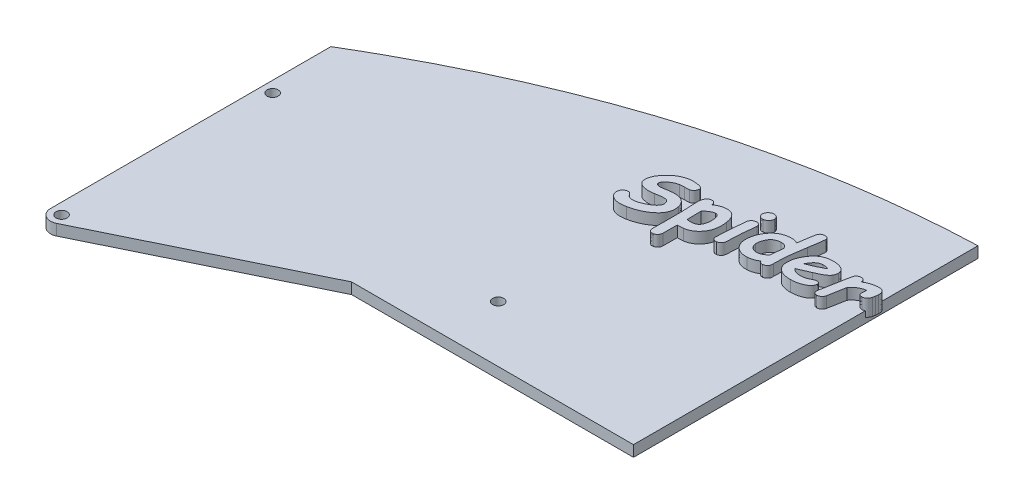
from build123d import *

# Parameters (mm, degrees)
SKETCH1_R           = 5
BOSS_EXTRUDE1_DEPTH = 5
BOSS_EXTRUDE4_DEPTH = 5
BOSS_EXTRUDE5_DEPTH = 15
BOSS_EXTRUDE6_DEPTH = 15


with BuildPart() as part:
    # Sketch1 → Boss-Extrude1 (new, symmetric)
    with BuildSketch(Plane(origin=(0, 0, 0), x_dir=(1, 0, 0), z_dir=(0, 1, 0))):
        with BuildLine():
            Line((-276.16, -130), (-276.16, 61.45))
            ThreePointArc((-276.16, 61.45), (-272.385116744, 69.276105131), (-263.910415696, 71.193683619))
            Line((-263.910415696, 71.193683619), (2.249584304, 9.743683619))
            ThreePointArc((2.249584304, 9.743683619), (9.935404568, 1.134784593), (4.388758686, -8.985477015))
            Line((4.388758686, -8.985477015), (0, -11.129069701))
            Line((0, -11.129069701), (173.84, -11.129069701))
            Line((173.84, -11.129069701), (173.84, -51.129069701))
            Line((173.84, -51.129069701), (0, -51.129069701))
            Line((0, -51.129069701), (-81.895384615, -51.129069701))
            Line((-81.895384615, -51.129069701), (-261.771241314, -138.985477015))
            ThreePointArc((-261.771241314, -138.985477015), (-271.456810981, -138.481968724), (-276.16, -130))
        make_face()
        with Locations(Location((-266.16, 61.45, 0), (0, 0, 270))):
            Circle(SKETCH1_R, mode=Mode.SUBTRACT)
        with Locations(Location((0, 0, 0), (0, 0, 270))):
            Circle(SKETCH1_R, mode=Mode.SUBTRACT)
        with Locations(Location((-266.16, -130, 0), (0, 0, 270))):
            Circle(SKETCH1_R, mode=Mode.SUBTRACT)
    extrude(amount=BOSS_EXTRUDE1_DEPTH, both=True)

    # Sketch6 → Boss-Extrude4 (add, symmetric)
    with BuildSketch(Plane(origin=(0, 0, 0), x_dir=(1, 0, 0), z_dir=(0, 1, 0))):
        with BuildLine():
            Line((-276.16, 61.45), (-276.16, 124.312394844))
            add(Edge.make_bspline(
                [(-276.16, 124.312394844), (-60.151682098, 253.231064879), (173.84, 261.45)],
                knots=[0, 0, 0, 0.880135939, 0.880135939, 0.880135939], degree=2))
            Line((173.84, 261.45), (173.84, -11.129069701))
            Line((173.84, -11.129069701), (0, -11.129069701))
            Line((0, -11.129069701), (9.935404568, 1.134784593))
            Line((9.935404568, 1.134784593), (2.249584304, 9.743683619))
            Line((2.249584304, 9.743683619), (-263.910415696, 71.193683619))
            Line((-263.910415696, 71.193683619), (-276.16, 61.45))
        make_face()
    extrude(amount=BOSS_EXTRUDE4_DEPTH, both=True)

    # Sketch7 → Boss-Extrude5 (add)
    # profile 1 of 7: a face of its own
    with BuildSketch(Plane(origin=(0, 0, 0), x_dir=(1, 0, 0), z_dir=(0, 1, 0))):
        with BuildLine():
            add(Edge.make_bspline(
                [(176.518734712, 163.267618198), (176.456930799, 162.976702904), (176.333813279, 162.397180214), (175.989113084, 161.564369246), (175.524778373, 160.768651896), (174.945008319, 160.021929376), (174.247707671, 159.357338722), (173.37305975, 158.911121203), (172.377582905, 158.645804684), (171.670227243, 158.63476937), (171.300286997, 158.628998007)],
                knots=[0, 0, 0, 0, 0.929323082, 1.85127363, 2.806580006, 3.805490242, 4.804815835, 5.792818837, 6.845665359, 8, 8, 8, 8], degree=3))
            add(Edge.make_bspline(
                [(171.300286997, 158.628998007), (171.041712856, 158.642585868), (170.556196247, 158.668099371), (169.88191695, 158.822321589), (169.311439979, 159.074458954), (168.842525763, 159.416575587), (168.474091509, 159.855933557), (168.240541922, 160.396171683), (168.09897489, 161.01761733), (168.091946577, 161.459773402), (168.088226587, 161.693800633)],
                knots=[0, 0, 0, 0, 1.220790233, 2.292239788, 3.245151792, 4.146014003, 5.010153794, 5.917512134, 6.897767325, 8, 8, 8, 8], degree=3))
            add(Edge.make_bspline(
                [(168.088226587, 161.693800633), (168.097295909, 161.869017318), (168.116151999, 162.233311534), (168.176533877, 162.593092003), (168.207873536, 162.779826789)],
                knots=[0, 0, 0, 0, 0.961951506, 2, 2, 2, 2], degree=3))
            Line((168.207873536, 162.779826789), (168.566814384, 165.909054696))
            add(Edge.make_bspline(
                [(168.566814384, 165.909054696), (167.984314857, 165.820757636), (166.836729852, 165.646803192), (165.182177673, 165.165677393), (163.61656855, 164.540934536), (162.145417686, 163.752318941), (160.762525932, 162.812257349), (159.490964563, 161.691209798), (158.288797617, 160.430761645), (157.592093075, 159.48098847), (157.237168639, 158.997142466)],
                knots=[0, 0, 0, 0, 1.031863698, 2.032879432, 3.012618297, 3.982282115, 4.95342141, 5.936976143, 6.94902712, 8, 8, 8, 8], degree=3))
            Line((157.237168639, 158.997142466), (154.4024563, 143.498260716))
            add(Edge.make_bspline(
                [(154.4024563, 143.498260716), (154.335595854, 143.21594257), (154.203763456, 142.659280435), (153.834750012, 141.880992166), (153.325426801, 141.180921595), (152.697964433, 140.55968838), (151.964560789, 140.056749203), (151.157542763, 139.685470877), (150.27727386, 139.480258225), (149.669759615, 139.465452027), (149.358877203, 139.457875272)],
                knots=[0, 0, 0, 0, 0.987406431, 1.946923278, 2.913884298, 3.927496301, 4.943266075, 5.931282102, 6.941377896, 8, 8, 8, 8], degree=3))
            add(Edge.make_bspline(
                [(149.358877203, 139.457875272), (149.083458753, 139.47546062), (148.561023811, 139.508817863), (147.837057374, 139.763407596), (147.210366015, 140.139361085), (146.720295925, 140.679401896), (146.35731318, 141.320738733), (146.143445807, 142.054091021), (146.093732924, 142.865634424), (146.164735698, 143.419145424), (146.202038462, 143.709943781)],
                knots=[0, 0, 0, 0, 1.073170499, 2.035672514, 2.966705473, 3.899356348, 4.849093514, 5.823530431, 6.856547073, 8, 8, 8, 8], degree=3))
            Line((146.202038462, 143.709943781), (149.929501116, 163.967092671))
            Line((149.929501116, 163.967092671), (150.82225143, 168.384826187))
            add(Edge.make_bspline(
                [(150.82225143, 168.384826187), (150.885148455, 168.723335335), (151.001355023, 169.348754208), (151.227655734, 170.200790076), (151.444171429, 170.902724381), (151.703318414, 171.464486987), (152.00053857, 171.934982779), (152.37558185, 172.336451671), (152.81237468, 172.709816639), (153.318753481, 173.038419752), (153.880489995, 173.317547729), (154.501022543, 173.496295857), (155.155546721, 173.61576844), (155.607567561, 173.613589406), (155.838219693, 173.612477514)],
                knots=[0, 0, 0, 0, 1.529410258, 2.825690373, 3.916473868, 4.788712898, 5.567746583, 6.378466368, 7.219900511, 8.116104303, 9.055150556, 9.995383723, 10.977106855, 12, 12, 12, 12], degree=3))
            add(Edge.make_bspline(
                [(155.838219693, 173.612477514), (156.112505183, 173.597635906), (156.628013843, 173.569741695), (157.34702144, 173.382658517), (157.960885173, 173.086202476), (158.469357046, 172.676586316), (158.859617359, 172.150115827), (159.122934936, 171.514967312), (159.290727983, 170.780224016), (159.30805637, 170.254171524), (159.317184836, 169.977050975)],
                knots=[0, 0, 0, 0, 1.147678115, 2.157015324, 3.08752507, 3.982154202, 4.863220525, 5.800882371, 6.841521149, 8, 8, 8, 8], degree=3))
            add(Edge.make_bspline(
                [(159.317184836, 169.977050975), (159.837248027, 170.294992397), (160.860881516, 170.920792286), (162.456917279, 171.709320298), (164.056392142, 172.385054528), (165.669930695, 172.932241993), (167.298792754, 173.339605168), (168.939503058, 173.610377566), (170.594096073, 173.781222316), (171.701773389, 173.773042488), (172.257462592, 173.768938909)],
                knots=[0, 0, 0, 0, 1.068448707, 2.103013433, 3.11816224, 4.111711965, 5.08771541, 6.058843267, 7.026178632, 8, 8, 8, 8], degree=3))
            add(Edge.make_bspline(
                [(172.257462592, 173.768938909), (172.658216512, 173.743378014), (173.412483506, 173.695269342), (174.463938421, 173.408235211), (175.354850317, 172.942026896), (176.08678303, 172.292601161), (176.628328261, 171.453134444), (176.992682054, 170.450469804), (177.204031316, 169.28649798), (177.207283339, 168.456329656), (177.209005574, 168.016681727)],
                knots=[0, 0, 0, 0, 1.106444953, 2.082462242, 2.984149, 3.859766888, 4.752339812, 5.711830198, 6.788210675, 8, 8, 8, 8], degree=3))
            add(Edge.make_bspline(
                [(177.209005574, 168.016681727), (177.182952834, 167.592402928), (177.127940674, 166.696508955), (176.970014456, 165.812823027), (176.886879172, 165.347634395)],
                knots=[0, 0, 0, 0, 0.947162974, 2, 2, 2, 2], degree=3))
            Line((176.886879172, 165.347634395), (176.518734712, 163.267618198))
        make_face()
    # profile 2 of 7: a face of its own
    with BuildSketch(Plane(origin=(0, 0, 0), x_dir=(1, 0, 0), z_dir=(0, 1, 0))):
        with BuildLine():
            add(Edge.make_bspline(
                [(118.660529309, 150.443129323), (118.893382166, 150.187955108), (119.357461716, 149.679388729), (120.170216475, 149.034688231), (121.059673375, 148.486649564), (122.031991438, 148.046986532), (123.07713874, 147.702020601), (124.205534196, 147.479638551), (125.409021899, 147.333754286), (126.240776541, 147.332798958), (126.667671306, 147.332308639)],
                knots=[0, 0, 0, 0, 0.931654172, 1.85680199, 2.790369816, 3.746889916, 4.732010299, 5.755675512, 6.848109376, 8, 8, 8, 8], degree=3))
            add(Edge.make_bspline(
                [(126.667671306, 147.332308639), (127.332051762, 147.362115626), (128.633162388, 147.420489088), (130.520354747, 147.78118311), (132.302937103, 148.331176274), (133.395867004, 148.881419199), (133.938524384, 149.154623714)],
                knots=[0, 0, 0, 0, 1.053289028, 2.062742112, 3.038120113, 4, 4, 4, 4], degree=3))
            add(Edge.make_bspline(
                [(133.938524384, 149.154623714), (134.379220528, 149.393698389), (135.193908469, 149.835661082), (136.377290267, 150.318646184), (137.393196427, 150.659540748), (138.032210282, 150.719773994), (138.319443453, 150.746848502)],
                knots=[0, 0, 0, 0, 1.279371579, 2.365095794, 3.265119661, 4, 4, 4, 4], degree=3))
            add(Edge.make_bspline(
                [(138.319443453, 150.746848502), (138.534690928, 150.744027953), (138.937339179, 150.738751751), (139.502654435, 150.635934382), (139.986963291, 150.467115843), (140.391984407, 150.212842492), (140.701797494, 149.870443131), (140.928755973, 149.455034774), (141.053380181, 148.961980674), (141.077165904, 148.612270084), (141.089730512, 148.427538406)],
                knots=[0, 0, 0, 0, 1.247072542, 2.332810536, 3.318205731, 4.206908105, 5.076147483, 5.96822998, 6.926734577, 8, 8, 8, 8], degree=3))
            add(Edge.make_bspline(
                [(141.089730512, 148.427538406), (141.078963928, 148.128711151), (141.057698764, 147.5384951), (140.83632945, 146.669168028), (140.453193363, 145.846534306), (139.91369057, 145.064650366), (139.234778799, 144.310561298), (138.390305284, 143.607062655), (137.392451199, 142.943553416), (136.265816558, 142.322666262), (135.051234163, 141.751152593), (133.781984645, 141.254772702), (132.489062406, 140.823822901), (131.163962346, 140.456207449), (129.805218978, 140.191202564), (128.418927069, 139.970225312), (127.001052235, 139.846243095), (126.045085783, 139.811874211), (125.563237927, 139.794550828)],
                knots=[0, 0, 0, 0, 0.741873545, 1.465280245, 2.212780045, 2.987160223, 3.818964515, 4.728306554, 5.712126274, 6.794625551, 7.924161431, 9.047498119, 10.181276281, 11.311970725, 12.46392634, 13.621551001, 14.801160282, 16, 16, 16, 16], degree=3))
            add(Edge.make_bspline(
                [(125.563237927, 139.794550828), (124.980168145, 139.797168184), (123.846407125, 139.80225755), (122.191335021, 139.918948556), (120.634273353, 140.146594005), (119.171773073, 140.483095952), (117.79808658, 140.894426536), (116.527703483, 141.435853435), (115.352669033, 142.072257407), (114.273733374, 142.803169151), (113.319118555, 143.636442517), (112.470344469, 144.529327278), (111.757618251, 145.506073008), (111.165405625, 146.548797382), (110.699668216, 147.664073899), (110.37302822, 148.852066001), (110.153156126, 150.110035842), (110.118757119, 150.975991974), (110.101170623, 151.418712141)],
                knots=[0, 0, 0, 0, 1.283318363, 2.495372563, 3.649128548, 4.743523394, 5.796652645, 6.801376746, 7.777480309, 8.734687246, 9.663528147, 10.561764431, 11.441116455, 12.318157364, 13.196107863, 14.09409023, 15.025603424, 16, 16, 16, 16], degree=3))
            add(Edge.make_bspline(
                [(110.101170623, 151.418712141), (110.108121397, 152.051284534), (110.122033493, 153.317389247), (110.350253608, 155.212724449), (110.750290491, 157.095654492), (111.310462067, 158.96989884), (112.055902915, 160.825383347), (112.961484593, 162.670466008), (114.03477375, 164.506756407), (115.25718423, 166.304568749), (116.613190919, 168.001842681), (118.121962571, 169.491571336), (119.742739643, 170.766499532), (121.481987504, 171.815188107), (123.341376021, 172.626412099), (125.303404022, 173.229659125), (127.38397887, 173.604312655), (128.810571059, 173.668084374), (129.539198091, 173.700655559)],
                knots=[0, 0, 0, 0, 0.927231402, 1.855869874, 2.793878035, 3.747563106, 4.72090259, 5.722965816, 6.759319796, 7.837527429, 8.909106018, 9.939907564, 10.939847407, 11.926735692, 12.909832251, 13.907492027, 14.931258783, 16, 16, 16, 16], degree=3))
            add(Edge.make_bspline(
                [(129.539198091, 173.700655559), (130.014733549, 173.70112331), (130.941762341, 173.702035161), (132.29134831, 173.644668348), (133.559094819, 173.500641565), (134.749974949, 173.313486238), (135.859252335, 173.055356278), (136.89386798, 172.74659137), (137.839481499, 172.357339067), (138.70803141, 171.919568993), (139.486048819, 171.420935783), (140.169705743, 170.872716155), (140.752070751, 170.263555778), (141.232741835, 169.602775367), (141.603846016, 168.884546089), (141.875026819, 168.117230765), (142.042164189, 167.295854012), (142.069696928, 166.728158281), (142.083720553, 166.439006093)],
                knots=[0, 0, 0, 0, 1.408853043, 2.746477291, 3.999137191, 5.187076673, 6.315930071, 7.371097975, 8.382124301, 9.341453258, 10.249098412, 11.115007308, 11.931467126, 12.738717787, 13.527384673, 14.317934821, 15.143250866, 16, 16, 16, 16], degree=3))
            add(Edge.make_bspline(
                [(142.083720553, 166.439006093), (142.080521981, 166.162529343), (142.074203917, 165.616411157), (141.960722392, 164.813819334), (141.767117093, 164.041999602), (141.488442222, 163.306112321), (141.137762173, 162.595369598), (140.692159744, 161.927097963), (140.171757509, 161.285836903), (139.562604883, 160.668184306), (138.833843148, 160.062239276), (137.975496891, 159.434649263), (136.961889343, 158.798417347), (135.805739651, 158.135647629), (134.508803665, 157.445095451), (133.059447702, 156.740951888), (131.4694316, 156.001756871), (130.350503568, 155.523467598), (129.769288378, 155.275025355)],
                knots=[0, 0, 0, 0, 0.748633269, 1.478758134, 2.190524498, 2.90083282, 3.60723832, 4.333566851, 5.072349253, 5.842462199, 6.680192169, 7.637981556, 8.721933263, 9.921186994, 11.248907463, 12.702658412, 14.287231205, 16, 16, 16, 16], degree=3))
            Line((129.769288378, 155.275025355), (118.660529309, 150.443129323))
        make_face()
        with BuildLine():
            Line((119.093099049, 158.33062437), (126.56643158, 161.432241442))
            add(Edge.make_bspline(
                [(126.56643158, 161.432241442), (127.227452097, 161.735975405), (128.516819059, 162.328429837), (130.377296144, 163.245181252), (132.109349073, 164.178726896), (133.215829762, 164.813761787), (133.754452154, 165.12288965)],
                knots=[0, 0, 0, 0, 1.079829896, 2.106284078, 3.078160326, 4, 4, 4, 4], degree=3))
            add(Edge.make_bspline(
                [(133.754452154, 165.12288965), (133.4190377, 165.29810493), (132.712430039, 165.667225753), (131.478885921, 165.987440346), (130.073461871, 166.181374979), (129.073697699, 166.187350066), (128.54520805, 166.190508583)],
                knots=[0, 0, 0, 0, 0.841563456, 1.772896718, 2.822721333, 4, 4, 4, 4], degree=3))
            add(Edge.make_bspline(
                [(128.54520805, 166.190508583), (128.073322068, 166.158202423), (127.139210334, 166.094251458), (125.774784062, 165.700311702), (124.48624561, 165.061864714), (123.254374142, 164.192073648), (122.102287742, 163.069611303), (121.016468777, 161.711708262), (119.990437912, 160.119583954), (119.400902846, 158.944270536), (119.093099049, 158.33062437)],
                knots=[0, 0, 0, 0, 0.872762196, 1.727657613, 2.605567808, 3.521657875, 4.50472728, 5.569754289, 6.731137637, 8, 8, 8, 8], degree=3))
        make_face(mode=Mode.SUBTRACT)
    # profile 3 of 7: a face of its own
    with BuildSketch(Plane(origin=(0, 0, 0), x_dir=(1, 0, 0), z_dir=(0, 1, 0))):
        with BuildLine():
            add(Edge.make_bspline(
                [(99.380964136, 171.256918432), (99.512612117, 172.183449642), (99.763763079, 173.951036221), (100.126554836, 176.474137885), (100.483658494, 178.736167077), (100.787934216, 180.748028383), (101.089480419, 182.500691115), (101.337554691, 184.003770035), (101.581186388, 185.245082956), (101.786982296, 186.263624736), (102.024090248, 187.11366756), (102.352101743, 187.839447959), (102.786349717, 188.456339993), (103.292488411, 188.982711076), (103.898689594, 189.389987686), (104.578707859, 189.711160991), (105.356752626, 189.909406779), (105.905295866, 189.965953772), (106.191636639, 189.995471426)],
                knots=[0, 0, 0, 0, 2.093012271, 3.992936623, 5.700836037, 7.214682637, 8.543456784, 9.678229977, 10.621528112, 11.372456875, 12.002053847, 12.59148728, 13.143470454, 13.682028092, 14.2149177, 14.767454967, 15.356608793, 16, 16, 16, 16], degree=3))
            add(Edge.make_bspline(
                [(106.191636639, 189.995471426), (106.46784637, 190.003899101), (106.986254222, 190.019716693), (107.722607876, 189.915463342), (108.350623141, 189.677753689), (108.896784513, 189.352228595), (109.306541238, 188.875740957), (109.628378335, 188.309219304), (109.83987717, 187.625072941), (109.885692908, 187.128542389), (109.909895681, 186.86624352)],
                knots=[0, 0, 0, 0, 1.190254643, 2.233945014, 3.179698034, 4.071286247, 4.942233965, 5.854283231, 6.866496575, 8, 8, 8, 8], degree=3))
            add(Edge.make_bspline(
                [(109.909895681, 186.86624352), (109.910305311, 186.7834072), (109.911261324, 186.590079851), (109.901326468, 186.255432121), (109.8753036, 185.834398814), (109.812117516, 185.326440566), (109.753053908, 184.730362059), (109.667875243, 184.049490213), (109.566700054, 183.285568119), (109.446701198, 182.435781931), (109.304579378, 181.498060572), (109.166261004, 180.471134319), (108.980853356, 179.363101752), (108.805262922, 178.164335468), (108.587580032, 176.883896307), (108.368188552, 175.511824667), (108.130774369, 174.057334402), (107.962253718, 173.057682447), (107.875897542, 172.54542404)],
                knots=[0, 0, 0, 0, 0.274720035, 0.641154705, 1.110190553, 1.67312553, 2.338312645, 3.096797245, 3.948691282, 4.894073523, 5.943066964, 7.094215999, 8.330403817, 9.668691931, 11.112261336, 12.637805281, 14.277087839, 16, 16, 16, 16], degree=3))
            add(Edge.make_bspline(
                [(107.875897542, 172.54542404), (107.729067872, 171.689917254), (107.440946874, 170.011172969), (107.061779486, 167.533159266), (106.696121273, 165.151271913), (106.383069116, 162.86234873), (106.120373701, 160.664375785), (105.875166411, 158.564074964), (105.683480571, 156.553858744), (105.529552004, 154.648134485), (105.400394589, 152.868694373), (105.301388943, 151.233148968), (105.214581803, 149.757813104), (105.160765285, 148.43524761), (105.123722509, 147.269416674), (105.101043102, 146.256946104), (105.10872033, 145.400567897), (105.131966765, 144.882394674), (105.142424929, 144.649277612)],
                knots=[0, 0, 0, 0, 1.484364393, 2.912739303, 4.286870655, 5.605341729, 6.863215692, 8.072355805, 9.221361243, 10.31624723, 11.341924858, 12.272325893, 13.118312011, 13.869204645, 14.535825482, 15.113022817, 15.600964493, 16, 16, 16, 16], degree=3))
            add(Edge.make_bspline(
                [(105.142424929, 144.649277612), (105.154655196, 144.413105348), (105.177679197, 143.968500955), (105.164666113, 143.335726883), (105.135916095, 142.778135061), (105.055659732, 142.270270634), (104.881516258, 141.781451859), (104.570319554, 141.291072623), (104.142904384, 140.76437409), (103.596109653, 140.234625255), (102.973572657, 139.726209999), (102.266103975, 139.350750218), (101.514712968, 139.087047931), (100.990624293, 139.028147428), (100.724691413, 138.998260157)],
                knots=[0, 0, 0, 0, 1.051252687, 1.979028168, 2.812994602, 3.532940103, 4.257908989, 5.102519403, 6.101764177, 7.2690366, 8.483506227, 9.661570794, 10.813435124, 12, 12, 12, 12], degree=3))
            add(Edge.make_bspline(
                [(100.724691413, 138.998260157), (100.53739013, 138.993421362), (100.176801985, 138.984105826), (99.652655068, 139.049094109), (99.170615614, 139.181945567), (98.738480094, 139.405944158), (98.340051768, 139.67583832), (97.993950322, 140.029840354), (97.68757026, 140.443955702), (97.529487651, 140.759546469), (97.448205723, 140.921814959)],
                knots=[0, 0, 0, 0, 1.102563406, 2.122629841, 3.100842829, 4.030422413, 4.97810109, 5.92388182, 6.932514518, 8, 8, 8, 8], degree=3))
            add(Edge.make_bspline(
                [(97.448205723, 140.921814959), (97.086272439, 140.692482669), (96.367172665, 140.23683848), (95.243458082, 139.654483309), (94.104167809, 139.142012848), (92.946680657, 138.713431523), (91.774759322, 138.349078429), (90.581391552, 138.072466777), (89.369182206, 137.878948235), (88.551937049, 137.80910035), (88.143354506, 137.774179829)],
                knots=[0, 0, 0, 0, 1.034907349, 2.056184593, 3.054991914, 4.051899287, 5.036744336, 6.018543653, 7.009368894, 8, 8, 8, 8], degree=3))
            add(Edge.make_bspline(
                [(88.143354506, 137.774179829), (87.612605358, 137.753050453), (86.578095871, 137.711866138), (85.063548021, 137.79938405), (83.624836602, 137.992360193), (82.274440266, 138.3390105), (80.99646118, 138.787111914), (79.80568948, 139.374442808), (78.683266964, 140.069572993), (77.667286896, 140.905780689), (76.742505316, 141.817706166), (75.928135618, 142.800000241), (75.221328049, 143.836449706), (74.632291552, 144.935888988), (74.150676109, 146.091788274), (73.784279005, 147.30366216), (73.517172264, 148.572191684), (73.445056929, 149.443106195), (73.408372509, 149.88613255)],
                knots=[0, 0, 0, 0, 1.18951681, 2.31854621, 3.394692272, 4.43668464, 5.436843195, 6.423684731, 7.405894818, 8.388201114, 9.365201779, 10.312216062, 11.242619186, 12.171421166, 13.1020528, 14.043587687, 15.004790704, 16, 16, 16, 16], degree=3))
            add(Edge.make_bspline(
                [(73.408372509, 149.88613255), (73.383647466, 150.558064928), (73.334594033, 151.891150169), (73.480793889, 153.878653009), (73.795534876, 155.833772876), (74.281100575, 157.761351375), (74.959486584, 159.653511089), (75.811686777, 161.512020003), (76.840733064, 163.337451165), (78.019364832, 165.118069238), (79.356285987, 166.781858667), (80.832112017, 168.266942475), (82.440298473, 169.534862532), (84.159282501, 170.616371065), (86.015028095, 171.471345471), (87.986381122, 172.128347043), (90.083804426, 172.574077781), (91.528311964, 172.707384026), (92.266572453, 172.775514328)],
                knots=[0, 0, 0, 0, 0.978479588, 1.941261862, 2.895999431, 3.859196161, 4.831302022, 5.818795368, 6.832810011, 7.879746314, 8.924851139, 9.935662715, 10.921467199, 11.900711292, 12.886019692, 13.8890027, 14.921109195, 16, 16, 16, 16], degree=3))
            add(Edge.make_bspline(
                [(92.266572453, 172.775514328), (92.637679618, 172.791249247), (93.361352682, 172.821932936), (94.41619084, 172.809087835), (95.406660971, 172.71589464), (96.329785158, 172.560457012), (97.192471387, 172.344814616), (97.982974939, 172.043641672), (98.723222085, 171.70247107), (99.163602833, 171.404158374), (99.380964136, 171.256918432)],
                knots=[0, 0, 0, 0, 1.201803594, 2.343562643, 3.410362982, 4.417288943, 5.370730641, 6.281622877, 7.151850551, 8, 8, 8, 8], degree=3))
        make_face()
        with BuildLine():
            add(Edge.make_bspline(
                [(97.853164628, 161.317018022), (97.709168289, 161.616973206), (97.430000252, 162.198501182), (96.864480297, 162.962345073), (96.221111402, 163.607481911), (95.476889767, 164.109245824), (94.653109548, 164.496928847), (93.733814494, 164.738298331), (92.72990421, 164.861258539), (92.036745564, 164.83645008), (91.677541318, 164.823594)],
                knots=[0, 0, 0, 0, 1.044146857, 2.024304434, 2.972467305, 3.895566795, 4.832077149, 5.821965218, 6.871312727, 8, 8, 8, 8], degree=3))
            add(Edge.make_bspline(
                [(91.677541318, 164.823594), (91.213030117, 164.78408371), (90.311152067, 164.707371969), (89.017973688, 164.437833698), (87.82952259, 164.054930066), (86.752574927, 163.542854662), (85.774289357, 162.923670435), (84.901686487, 162.182163482), (84.141154261, 161.318974329), (83.508245716, 160.349868819), (82.966988801, 159.335666891), (82.492404498, 158.31353839), (82.110409472, 157.289843672), (81.786894502, 156.276327399), (81.572575649, 155.257808626), (81.417905595, 154.247406645), (81.364385831, 153.236572049), (81.386205022, 152.56740973), (81.397107283, 152.233053481)],
                knots=[0, 0, 0, 0, 1.226934033, 2.382170481, 3.470684932, 4.508002166, 5.514427839, 6.511795531, 7.513637283, 8.533307029, 9.552848709, 10.539885478, 11.498840503, 12.429147015, 13.338873689, 14.237044141, 15.119114611, 16, 16, 16, 16], degree=3))
            add(Edge.make_bspline(
                [(81.397107283, 152.233053481), (81.415872231, 151.995994201), (81.452988964, 151.527095166), (81.608207352, 150.847970847), (81.807697252, 150.195556544), (82.077831413, 149.5810536), (82.39729736, 148.991313055), (82.802076543, 148.451343227), (83.250618402, 147.930232814), (83.767029212, 147.457288019), (84.318224602, 147.027302145), (84.907633027, 146.666547195), (85.51507357, 146.358875135), (86.151438948, 146.121215643), (86.807825278, 145.943850531), (87.486497068, 145.837489697), (88.188502124, 145.773705476), (88.664818324, 145.79705049), (88.907254259, 145.80893266)],
                knots=[0, 0, 0, 0, 1.034968957, 2.047150178, 3.028124661, 4.004167297, 4.967677145, 5.943719781, 6.93853506, 7.960207335, 8.989721987, 9.980306096, 10.966822082, 11.952613088, 12.935226018, 13.924275248, 14.943495366, 16, 16, 16, 16], degree=3))
            add(Edge.make_bspline(
                [(88.907254259, 145.80893266), (89.245790839, 145.841456139), (89.929097773, 145.907101979), (90.94155203, 146.142134206), (91.940143122, 146.489022535), (92.934366019, 146.929121409), (93.907567245, 147.502601399), (94.889166764, 148.160040905), (95.844367655, 148.949453619), (96.454752641, 149.532510938), (96.767138472, 149.830910881)],
                knots=[0, 0, 0, 0, 0.903688745, 1.824017911, 2.755418455, 3.712200489, 4.709984491, 5.755428712, 6.851262264, 8, 8, 8, 8], degree=3))
            add(Edge.make_bspline(
                [(96.767138472, 149.830910881), (96.767302018, 149.889196036), (96.767689361, 150.027239823), (96.763482208, 150.272957425), (96.787694426, 150.588802379), (96.813829609, 150.981515412), (96.85398408, 151.444319327), (96.884698443, 151.982137442), (96.94514348, 152.588940175), (97.008070333, 153.270123704), (97.082280348, 154.024776551), (97.165136553, 154.853097146), (97.256557798, 155.752050407), (97.359273442, 156.724412037), (97.468209011, 157.767648376), (97.589493677, 158.887246872), (97.716831211, 160.077744517), (97.806929883, 160.896743257), (97.853164628, 161.317018022)],
                knots=[0, 0, 0, 0, 0.242447582, 0.574217958, 1.021560497, 1.558862703, 2.211641618, 2.953502731, 3.799162018, 4.747646866, 5.798967464, 6.953131276, 8.210143932, 9.557318191, 11.020040682, 12.572934589, 14.241378115, 16, 16, 16, 16], degree=3))
        make_face(mode=Mode.SUBTRACT)
    # profile 4 of 7: a face of its own
    with BuildSketch(Plane(origin=(0, 0, 0), x_dir=(1, 0, 0), z_dir=(0, 1, 0))):
        with BuildLine():
            add(Edge.make_bspline(
                [(61.000585691, 178.102373044), (60.98774065, 178.447050094), (60.962294009, 179.129871871), (61.206434726, 180.14041215), (61.683131454, 181.092103098), (62.372019462, 181.95086764), (63.183914726, 182.709927438), (64.09145072, 183.293641606), (65.063633646, 183.703907308), (65.746048176, 183.810220953), (66.090182845, 183.863833837)],
                knots=[0, 0, 0, 0, 0.974232978, 1.930002285, 2.910273955, 3.969915742, 5.034827994, 6.048191869, 7.015723117, 8, 8, 8, 8], degree=3))
            add(Edge.make_bspline(
                [(66.090182845, 183.863833837), (66.372893667, 183.881861995), (66.926831046, 183.917185972), (67.738186751, 183.766844291), (68.503823448, 183.490308667), (69.193187633, 183.056930951), (69.786986114, 182.522073656), (70.257812698, 181.903112374), (70.558900255, 181.192745446), (70.64096659, 180.688058918), (70.682784979, 180.430886751)],
                knots=[0, 0, 0, 0, 1.063388612, 2.0835803, 3.081740158, 4.114356611, 5.128772592, 6.078674018, 7.020953527, 8, 8, 8, 8], degree=3))
            add(Edge.make_bspline(
                [(70.682784979, 180.430886751), (70.695631464, 180.092270704), (70.721196403, 179.418413324), (70.473840166, 178.419675741), (70.006222713, 177.466541133), (69.330679674, 176.589888697), (68.520634142, 175.81494993), (67.600448439, 175.214900588), (66.603753236, 174.789140688), (65.894641869, 174.684995479), (65.537966155, 174.632611512)],
                knots=[0, 0, 0, 0, 0.948731928, 1.888008606, 2.85618084, 3.915272521, 4.982932903, 5.992402328, 6.990199052, 8, 8, 8, 8], degree=3))
            add(Edge.make_bspline(
                [(65.537966155, 174.632611512), (65.249195298, 174.618484125), (64.689229779, 174.591089221), (63.872197672, 174.734279362), (63.118310287, 175.025228097), (62.444372291, 175.458590405), (61.859256098, 175.994208147), (61.42445446, 176.633688433), (61.111396498, 177.338267998), (61.037962852, 177.844635747), (61.000585691, 178.102373044)],
                knots=[0, 0, 0, 0, 1.088663671, 2.111065232, 3.104660952, 4.119888139, 5.11947247, 6.076770165, 7.021090778, 8, 8, 8, 8], degree=3))
        make_face()
    # profile 5 of 7: a face of its own
    with BuildSketch(Plane(origin=(0, 0, 0), x_dir=(1, 0, 0), z_dir=(0, 1, 0))):
        with BuildLine():
            add(Edge.make_bspline(
                [(61.966964897, 135.949832417), (61.696777589, 135.93380127), (61.178281669, 135.903037115), (60.425383115, 136.01763678), (59.743509698, 136.254596942), (59.146268857, 136.626731066), (58.659951209, 137.111236808), (58.268375226, 137.670593691), (58.017395265, 138.32554536), (57.945413653, 138.791809347), (57.90817223, 139.033042266)],
                knots=[0, 0, 0, 0, 1.131533257, 2.171439445, 3.16759927, 4.137790864, 5.092270162, 6.026450238, 6.978936432, 8, 8, 8, 8], degree=3))
            Line((57.90817223, 139.033042266), (58.138262517, 145.392737806))
            add(Edge.make_bspline(
                [(58.138262517, 145.392737806), (58.178748998, 146.460644624), (58.259540693, 148.591677009), (58.479167988, 151.773168151), (58.747104789, 154.934925201), (58.99174068, 157.029735631), (59.113845335, 158.07531444)],
                knots=[0, 0, 0, 0, 1.007801441, 2.011090738, 3.007279443, 4, 4, 4, 4], degree=3))
            add(Edge.make_bspline(
                [(59.113845335, 158.07531444), (59.163580911, 158.449508591), (59.260143523, 159.176013977), (59.389569779, 160.231371229), (59.496200552, 161.219980804), (59.605206398, 162.135929737), (59.671281538, 162.98704031), (59.744020754, 163.765289671), (59.775799908, 164.477875388), (59.794983304, 164.928942552), (59.804116197, 165.143688065)],
                knots=[0, 0, 0, 0, 1.275123043, 2.475676754, 3.591478597, 4.634038142, 5.591039936, 6.474884316, 7.273917997, 8, 8, 8, 8], degree=3))
            add(Edge.make_bspline(
                [(59.804116197, 165.143688065), (59.833332365, 165.424935481), (59.891394124, 165.983862973), (60.169876845, 166.790737239), (60.601655495, 167.547998644), (61.18064696, 168.23210801), (61.849475121, 168.843161404), (62.613914667, 169.304256342), (63.438304957, 169.633125616), (64.019641301, 169.719953122), (64.313885827, 169.763901034)],
                knots=[0, 0, 0, 0, 0.966631397, 1.92100205, 2.900531148, 3.938593558, 4.981279403, 5.991211535, 6.983247795, 8, 8, 8, 8], degree=3))
            add(Edge.make_bspline(
                [(64.313885827, 169.763901034), (64.571838466, 169.780032922), (65.066001214, 169.810936961), (65.785354704, 169.695065922), (66.442310165, 169.455851422), (67.021309095, 169.080389128), (67.524714642, 168.618365366), (67.899767693, 168.044130038), (68.165364649, 167.390650822), (68.235329436, 166.916302284), (68.271438768, 166.671487573)],
                knots=[0, 0, 0, 0, 1.097534467, 2.102559017, 3.077946549, 4.052721647, 5.022935138, 5.964862665, 6.949650901, 8, 8, 8, 8], degree=3))
            add(Edge.make_bspline(
                [(68.271438768, 166.671487573), (68.279904413, 166.54265591), (68.299853205, 166.239071702), (68.266690325, 165.704811295), (68.236162999, 165.023464465), (68.169732016, 164.188424206), (68.06260371, 163.210967414), (67.948115743, 162.077624113), (67.785850009, 160.799670545), (67.556036955, 158.904112733), (67.253201081, 156.469188603), (66.994093697, 153.549658133), (66.792984228, 150.687105116), (66.70894154, 148.353637243), (66.662905069, 146.570743228), (66.625477952, 145.355878301), (66.589713461, 144.25445975), (66.55144373, 143.269752439), (66.519902783, 142.397990805), (66.467002875, 141.640979503), (66.437459697, 140.995713157), (66.376955858, 140.306403891), (66.270972244, 139.543045982), (65.969213405, 138.718364758), (65.538115043, 137.969096176), (64.967290802, 137.324991487), (64.308026935, 136.786913978), (63.587234309, 136.355650369), (62.79612151, 136.080927297), (62.244819421, 135.993762967), (61.966964897, 135.949832417)],
                knots=[0, 0, 0, 0, 0.326783302, 0.770045563, 1.353755082, 2.05532488, 2.891284703, 3.844805691, 4.940842652, 6.154480218, 8.682067358, 11.155999296, 13.57851694, 15.950734099, 17.070297532, 18.096639213, 19.029766979, 19.861924908, 20.593130373, 21.239354865, 21.78426472, 22.228955437, 22.993001699, 23.728038187, 24.438505214, 25.171072367, 25.894513186, 26.587638116, 27.288174039, 28, 28, 28, 28], degree=3))
        make_face()
    # profile 6 of 7: a face of its own
    with BuildSketch(Plane(origin=(0, 0, 0), x_dir=(1, 0, 0), z_dir=(0, 1, 0))):
        with BuildLine():
            Line((31.112883218, 131.340611278), (31.057661549, 118.519980472))
            add(Edge.make_bspline(
                [(31.057661549, 118.519980472), (31.044988221, 118.217701376), (31.020026917, 117.622334408), (30.776690529, 116.762336762), (30.397033917, 115.960284014), (29.871042979, 115.23533463), (29.231654033, 114.613447547), (28.501515507, 114.115211591), (27.687162918, 113.75441265), (27.103248827, 113.637326755), (26.80559304, 113.577641101)],
                knots=[0, 0, 0, 0, 1.019054911, 2.007124009, 2.99454063, 4.00417092, 5.015608204, 5.992965617, 6.976895047, 8, 8, 8, 8], degree=3))
            add(Edge.make_bspline(
                [(26.80559304, 113.577641101), (26.536013994, 113.546093376), (26.017877526, 113.485457999), (25.259685203, 113.559455605), (24.573271522, 113.773253673), (23.968909251, 114.117532395), (23.459434683, 114.571104744), (23.05911005, 115.114522418), (22.760386801, 115.738641256), (22.666549888, 116.194606724), (22.617949812, 116.430760663)],
                knots=[0, 0, 0, 0, 1.142531424, 2.195968882, 3.186551036, 4.154554801, 5.107912132, 6.042369899, 6.986102908, 8, 8, 8, 8], degree=3))
            add(Edge.make_bspline(
                [(22.617949812, 116.430760663), (22.610962213, 116.479776069), (22.592699117, 116.607884878), (22.591243269, 116.84200351), (22.579500839, 117.160813286), (22.569187281, 117.562764883), (22.572892737, 118.050597908), (22.571498995, 118.62428815), (22.572576374, 119.280809455), (22.569506417, 120.023267576), (22.582517944, 120.848483782), (22.590319389, 121.75965119), (22.60058158, 122.75363094), (22.606594237, 123.830527826), (22.628604749, 124.993167573), (22.646350051, 126.238729829), (22.66242993, 127.57027541), (22.681647189, 128.484436033), (22.691578704, 128.956875902)],
                knots=[0, 0, 0, 0, 0.189524176, 0.495348679, 0.895150366, 1.412450695, 2.035401588, 2.764136596, 3.610409508, 4.550712744, 5.608619181, 6.772303797, 8.04176758, 9.417011291, 10.898175444, 12.496863785, 14.189572849, 16, 16, 16, 16], degree=3))
            add(Edge.make_bspline(
                [(22.691578704, 128.956875902), (22.702433145, 130.426374521), (22.723552649, 133.285580485), (22.727006836, 137.451908986), (22.687022181, 141.378859233), (22.628279781, 145.066787414), (22.524054011, 148.518190168), (22.400443159, 151.727767089), (22.235671438, 154.697780079), (22.09597732, 156.59549926), (22.028918676, 157.506478746)],
                knots=[0, 0, 0, 0, 1.234649606, 2.402259841, 3.500325815, 4.534063202, 5.501043714, 6.4013168, 7.23256949, 8, 8, 8, 8], degree=3))
            add(Edge.make_bspline(
                [(22.028918676, 157.506478746), (22.007883441, 157.825362633), (21.966856502, 158.447310995), (21.950758732, 159.357440852), (22.012885565, 160.21738547), (22.104486361, 161.031773123), (22.277431258, 161.795454943), (22.481842913, 162.520285983), (22.761114832, 163.18937271), (23.084408928, 163.811489968), (23.447294165, 164.373855733), (23.839681728, 164.877498727), (24.248075072, 165.324105654), (24.698370241, 165.689563235), (25.155384064, 166.013390829), (25.651174325, 166.245656478), (26.158702901, 166.442816401), (26.51562192, 166.504297203), (26.695149702, 166.535221618)],
                knots=[0, 0, 0, 0, 1.373472039, 2.678807929, 3.907519198, 5.076787815, 6.19654252, 7.268713854, 8.309290549, 9.305923056, 10.278724011, 11.180685212, 12.048163718, 12.871960013, 13.66916136, 14.447495931, 15.21910126, 16, 16, 16, 16], degree=3))
            add(Edge.make_bspline(
                [(26.695149702, 166.535221618), (26.970945025, 166.565065783), (27.499709842, 166.622284099), (28.276530024, 166.521716258), (28.977538088, 166.244585467), (29.591839166, 165.820376639), (30.103063127, 165.274986195), (30.478367457, 164.627226259), (30.704707064, 163.889830895), (30.737156003, 163.370785301), (30.75394237, 163.102274532)],
                knots=[0, 0, 0, 0, 1.088098278, 2.086141568, 3.044919637, 4.025310069, 4.998325398, 5.960436776, 6.944900613, 8, 8, 8, 8], degree=3))
            Line((30.75394237, 163.102274532), (30.671109866, 162.770944519))
            add(Edge.make_bspline(
                [(30.671109866, 162.770944519), (31.355851423, 163.224114293), (32.685239778, 164.103918672), (34.771470319, 165.151342796), (36.86160523, 165.922299238), (38.283840937, 166.197603897), (38.981971042, 166.332742166)],
                knots=[0, 0, 0, 0, 1.079737484, 2.096251387, 3.065510581, 4, 4, 4, 4], degree=3))
            add(Edge.make_bspline(
                [(38.981971042, 166.332742166), (39.407748375, 166.388523685), (40.232455868, 166.496569447), (41.445880673, 166.544233103), (42.593015861, 166.483548361), (43.675367439, 166.307543005), (44.691482037, 166.033188533), (45.64069635, 165.657006546), (46.516003442, 165.159527307), (47.327025538, 164.561643737), (48.068287902, 163.856140022), (48.738375168, 163.041396118), (49.339792478, 162.123658078), (49.880190111, 161.102115648), (50.33272973, 159.969078267), (50.743021177, 158.739845887), (51.058624724, 157.394569942), (51.221435735, 156.46121245), (51.305606828, 155.978679239)],
                knots=[0, 0, 0, 0, 1.117019166, 2.163605256, 3.155122202, 4.101415396, 5.011662343, 5.889291174, 6.750795179, 7.624201817, 8.505128722, 9.406686853, 10.363229372, 11.355998983, 12.40859667, 13.534566567, 14.725404232, 16, 16, 16, 16], degree=3))
            add(Edge.make_bspline(
                [(51.305606828, 155.978679239), (51.418682653, 155.117857441), (51.638194534, 153.44676098), (51.763234247, 150.987845046), (51.679497931, 148.663853055), (51.422791278, 146.467600543), (50.95138976, 144.404024174), (50.287987415, 142.468042272), (49.432010898, 140.660911189), (48.37638695, 139.008092647), (47.19069916, 137.510432397), (45.928765901, 136.154157633), (44.579808149, 134.972141265), (43.15700149, 133.951865297), (41.653529379, 133.099752266), (40.074504947, 132.403972065), (38.409657071, 131.882356213), (37.260579995, 131.675184218), (36.681068169, 131.570701566)],
                knots=[0, 0, 0, 0, 1.306571537, 2.536421683, 3.700895861, 4.803521395, 5.859920178, 6.880745599, 7.878422772, 8.862346238, 9.825912921, 10.750490736, 11.647141247, 12.521100259, 13.381434721, 14.243725194, 15.114261314, 16, 16, 16, 16], degree=3))
            add(Edge.make_bspline(
                [(36.681068169, 131.570701566), (36.196957413, 131.503576506), (35.243534656, 131.37137833), (33.826632592, 131.275370714), (32.452262917, 131.245926594), (31.554453145, 131.309395403), (31.112883218, 131.340611278)],
                knots=[0, 0, 0, 0, 1.049687118, 2.067286404, 3.049433154, 4, 4, 4, 4], degree=3))
        make_face()
        with BuildLine():
            add(Edge.make_bspline(
                [(31.011643491, 152.996709116), (31.02791797, 152.567236802), (31.061508345, 151.680809897), (31.095125693, 150.303130133), (31.132140081, 148.833632496), (31.171114661, 147.266052008), (31.198100741, 145.60627763), (31.214086121, 143.851386355), (31.233153617, 142.004535352), (31.244914323, 140.740567633), (31.25093739, 140.093245806)],
                knots=[0, 0, 0, 0, 0.79920004, 1.649541533, 2.562616258, 3.532723557, 4.565458531, 5.64945614, 6.796204742, 8, 8, 8, 8], degree=3))
            add(Edge.make_bspline(
                [(31.25093739, 140.093245806), (31.704018199, 140.020132818), (32.609368026, 139.874037841), (33.98380906, 139.811035526), (35.363094301, 139.840063158), (36.276732939, 139.953403516), (36.736289838, 140.010413302)],
                knots=[0, 0, 0, 0, 0.998877566, 1.995965429, 2.991977926, 4, 4, 4, 4], degree=3))
            add(Edge.make_bspline(
                [(36.736289838, 140.010413302), (37.078738362, 140.07602739), (37.746365619, 140.203946625), (38.690901322, 140.524705932), (39.538504771, 140.962508569), (40.296106898, 141.503645058), (40.963444736, 142.149782929), (41.529270668, 142.911848585), (42.012106931, 143.769462281), (42.376301021, 144.73046715), (42.675057135, 145.744736064), (42.913970636, 146.793223356), (43.089657145, 147.865859609), (43.199727563, 148.963225608), (43.244174441, 150.084874338), (43.228552644, 151.228334746), (43.131959117, 152.392181483), (43.02869428, 153.171973902), (42.976338429, 153.567333028)],
                knots=[0, 0, 0, 0, 1.00057845, 1.950697401, 2.853087952, 3.730840407, 4.61559579, 5.508995063, 6.447771357, 7.432711141, 8.452995395, 9.483198418, 10.518850002, 11.572631882, 12.648430674, 13.741090468, 14.85472021, 16, 16, 16, 16], degree=3))
            add(Edge.make_bspline(
                [(42.976338429, 153.567333028), (42.908088309, 153.949682217), (42.780453615, 154.664714244), (42.476275709, 155.64192473), (42.105379349, 156.459441927), (41.641819178, 157.113105403), (41.089856263, 157.601631256), (40.446141454, 157.90600741), (39.724955186, 158.041278309), (39.230510804, 157.986178218), (38.972767431, 157.957455709)],
                knots=[0, 0, 0, 0, 1.383194247, 2.586714481, 3.638386884, 4.570154967, 5.422926746, 6.234828739, 7.079853648, 8, 8, 8, 8], degree=3))
            add(Edge.make_bspline(
                [(38.972767431, 157.957455709), (38.645864954, 157.893779684), (37.979666199, 157.764013496), (36.989933504, 157.43321822), (35.994211652, 156.99008023), (34.997353091, 156.423648643), (34.000357409, 155.735730036), (33.000521896, 154.933239944), (31.991102191, 154.018351618), (31.345021644, 153.344445361), (31.011643491, 152.996709116)],
                knots=[0, 0, 0, 0, 0.836059992, 1.703817394, 2.614796862, 3.570868039, 4.579997498, 5.654979712, 6.789967387, 8, 8, 8, 8], degree=3))
        make_face(mode=Mode.SUBTRACT)
    # profile 7 of 7: a face of its own
    with BuildSketch(Plane(origin=(0, 0, 0), x_dir=(1, 0, 0), z_dir=(0, 1, 0))):
        with BuildLine():
            add(Edge.make_bspline(
                [(-22.552490946, 128.734875177), (-22.616934369, 129.132550359), (-22.741501274, 129.901242707), (-22.671591736, 131.049683295), (-22.397178253, 132.12570391), (-21.901346684, 133.103819016), (-21.24720696, 133.957182662), (-20.446841704, 134.642845568), (-19.528560805, 135.160669166), (-18.848959184, 135.336411607), (-18.50290189, 135.425900731)],
                knots=[0, 0, 0, 0, 1.105110249, 2.136139818, 3.138887845, 4.1387922, 5.131121412, 6.076462753, 7.020523091, 8, 8, 8, 8], degree=3))
            add(Edge.make_bspline(
                [(-18.50290189, 135.425900731), (-18.2888014, 135.459659666), (-17.871426569, 135.52547049), (-17.251658157, 135.519221685), (-16.668015039, 135.403637244), (-16.112639284, 135.201425432), (-15.59809106, 134.883693828), (-15.121123134, 134.466825192), (-14.677640856, 133.959181025), (-14.426812338, 133.567323514), (-14.296851439, 133.364291757)],
                knots=[0, 0, 0, 0, 1.030186968, 2.008281772, 2.930078911, 3.849214065, 4.805499713, 5.788700394, 6.854267097, 8, 8, 8, 8], degree=3))
            add(Edge.make_bspline(
                [(-14.296851439, 133.364291757), (-14.130503873, 133.088602261), (-13.80214842, 132.544415465), (-13.107027731, 131.882740133), (-12.290417573, 131.367909683), (-11.340302951, 131.005106483), (-10.258799099, 130.812460766), (-9.049817524, 130.764577607), (-7.710599063, 130.859547657), (-6.785343366, 131.029344211), (-6.298913054, 131.118610553)],
                knots=[0, 0, 0, 0, 0.86036131, 1.698277489, 2.545195136, 3.436060463, 4.407559971, 5.478380332, 6.674320787, 8, 8, 8, 8], degree=3))
            add(Edge.make_bspline(
                [(-6.298913054, 131.118610553), (-5.88021525, 131.211103333), (-5.035831735, 131.397632563), (-3.779799981, 131.786412211), (-2.510714498, 132.235254937), (-1.228212492, 132.760050683), (0.059221476, 133.370546817), (1.359088422, 134.055588737), (2.674990474, 134.805787651), (3.966674089, 135.62929223), (5.179185034, 136.48035471), (6.227149705, 137.378483812), (7.077315833, 138.300707714), (7.756314317, 139.228763237), (8.227490683, 140.185933338), (8.512070517, 141.156453889), (8.605260768, 142.153867621), (8.50509221, 142.807992276), (8.454476166, 143.13852716)],
                knots=[0, 0, 0, 0, 0.999475353, 2.015631571, 3.06323089, 4.1379574, 5.245191199, 6.384341731, 7.563578403, 8.77612935, 9.955344323, 11.015279049, 11.987343538, 12.87466489, 13.687297712, 14.461620184, 15.222643285, 16, 16, 16, 16], degree=3))
            add(Edge.make_bspline(
                [(8.454476166, 143.13852716), (8.400086909, 143.354326343), (8.29514477, 143.770703201), (8.079649037, 144.357929557), (7.785626834, 144.870493321), (7.448913559, 145.32537316), (7.048134333, 145.709672131), (6.585724123, 146.013669636), (6.078609449, 146.267364613), (5.494352261, 146.445035216), (4.810546064, 146.551320709), (3.994661452, 146.600682316), (3.032572899, 146.598975123), (1.920886631, 146.52897127), (0.662278749, 146.398699098), (-0.748220269, 146.199268375), (-2.30741417, 145.953333358), (-3.394051001, 145.754755944), (-3.961195735, 145.651113097)],
                knots=[0, 0, 0, 0, 0.750305533, 1.447687867, 2.100777283, 2.735924901, 3.350523195, 3.961629426, 4.595427817, 5.25633504, 6.011403112, 6.923821011, 8.009979742, 9.253414186, 10.677973124, 12.275500061, 14.056084178, 16, 16, 16, 16], degree=3))
            add(Edge.make_bspline(
                [(-3.961195735, 145.651113097), (-4.417600707, 145.572664896), (-5.315167703, 145.418388497), (-6.654990178, 145.272894902), (-7.960649911, 145.196782542), (-9.232612697, 145.199182388), (-10.47124416, 145.260049667), (-11.676506666, 145.397594937), (-12.847796853, 145.609711368), (-13.972434872, 145.889034543), (-15.022757233, 146.244202472), (-15.981179801, 146.659650041), (-16.813113901, 147.169930393), (-17.531163442, 147.7419115), (-18.134569479, 148.387281762), (-18.613395452, 149.109465084), (-18.98281229, 149.904239799), (-19.128342288, 150.470864131), (-19.202376364, 150.759117474)],
                knots=[0, 0, 0, 0, 1.260451353, 2.478806335, 3.666636365, 4.819178772, 5.939840114, 7.041069179, 8.118995947, 9.1783859, 10.192565668, 11.134686753, 12.015589243, 12.841231243, 13.627228717, 14.410158568, 15.191215272, 16, 16, 16, 16], degree=3))
            add(Edge.make_bspline(
                [(-19.202376364, 150.759117474), (-19.283254097, 151.260950056), (-19.446334495, 152.272836189), (-19.389085885, 153.837755364), (-19.132847664, 155.431984774), (-18.629305714, 157.058345945), (-17.905702358, 158.717542298), (-16.947805982, 160.407060185), (-15.754323011, 162.120171188), (-14.379154805, 163.846629326), (-12.862851919, 165.516315273), (-11.236693264, 167.041525234), (-9.539981948, 168.397256893), (-7.78005168, 169.591713098), (-5.948743799, 170.607568611), (-4.052754746, 171.457894627), (-2.086450312, 172.150007082), (-0.731077701, 172.467352301), (-0.049660852, 172.626898376)],
                knots=[0, 0, 0, 0, 0.771793893, 1.556231232, 2.36968712, 3.223219655, 4.138946645, 5.119193275, 6.173157396, 7.312605063, 8.475664115, 9.601800874, 10.701149455, 11.777027686, 12.834335702, 13.883212059, 14.935779756, 16, 16, 16, 16], degree=3))
            add(Edge.make_bspline(
                [(-0.049660852, 172.626898376), (0.507370581, 172.721529134), (1.682749288, 172.921207234), (3.567427447, 172.987692093), (5.649078461, 172.935542065), (7.47429458, 172.748747258), (8.939312056, 172.545800178), (9.929962784, 172.334687182), (10.789083654, 172.083863514), (11.511688931, 171.781421755), (12.105753449, 171.445150226), (12.561329109, 171.055435155), (12.88455227, 170.612985198), (12.987690523, 170.283724848), (13.037874688, 170.12351605)],
                knots=[0, 0, 0, 0, 1.447090832, 3.053471767, 4.823719678, 6.783345104, 7.753259183, 8.61403363, 9.377908334, 10.044020901, 10.61864852, 11.120283351, 11.571954694, 12, 12, 12, 12], degree=3))
            add(Edge.make_bspline(
                [(13.037874688, 170.12351605), (13.067840418, 169.881218906), (13.130328991, 169.375948283), (12.990291343, 168.573306306), (12.670533823, 167.733318277), (12.21830137, 166.86383106), (11.621491503, 166.046714274), (10.881657798, 165.373692854), (10.010014453, 164.888875462), (9.370502501, 164.716896341), (9.043507301, 164.62895999)],
                knots=[0, 0, 0, 0, 0.787084196, 1.641333927, 2.602979249, 3.691700327, 4.806356036, 5.861564279, 6.906575219, 8, 8, 8, 8], degree=3))
            add(Edge.make_bspline(
                [(9.043507301, 164.62895999), (8.758816512, 164.578145024), (8.143592133, 164.468332527), (7.127168551, 164.398922093), (5.957484913, 164.358753326), (5.122803945, 164.378966808), (4.680995455, 164.389666092)],
                knots=[0, 0, 0, 0, 0.792196504, 1.711957754, 2.788906745, 4, 4, 4, 4], degree=3))
            add(Edge.make_bspline(
                [(4.680995455, 164.389666092), (4.260688314, 164.400039135), (3.459799865, 164.419804801), (2.317165917, 164.382150001), (1.289144194, 164.298799941), (0.649195998, 164.185586679), (0.346094442, 164.13196497)],
                knots=[0, 0, 0, 0, 1.159143513, 2.208729192, 3.151592314, 4, 4, 4, 4], degree=3))
            add(Edge.make_bspline(
                [(0.346094442, 164.13196497), (-0.315045888, 163.966184413), (-1.650925507, 163.631213368), (-3.596820626, 162.838106214), (-5.478212723, 161.768092982), (-6.984775518, 160.723754389), (-8.095580075, 159.799022576), (-8.81635975, 159.116187491), (-9.40319413, 158.436768939), (-9.8724437, 157.779846582), (-10.197940928, 157.125644769), (-10.414873307, 156.492758579), (-10.483489618, 155.8600974), (-10.430167084, 155.452575191), (-10.403723779, 155.250479881)],
                knots=[0, 0, 0, 0, 1.643737045, 3.321284028, 5.051714897, 6.859443971, 7.73736719, 8.538621016, 9.25263215, 9.901720615, 10.481233717, 11.010452997, 11.50927139, 12, 12, 12, 12], degree=3))
            add(Edge.make_bspline(
                [(-10.403723779, 155.250479881), (-10.357429027, 155.089995734), (-10.26625393, 154.773930581), (-9.969905908, 154.364839118), (-9.571628385, 154.02416055), (-9.048989172, 153.768459642), (-8.415557727, 153.592139633), (-7.674388592, 153.477077877), (-6.821040187, 153.421211747), (-6.216094743, 153.4437655), (-5.893954148, 153.455775641)],
                knots=[0, 0, 0, 0, 0.755494605, 1.487907197, 2.260639638, 3.122771943, 4.112904287, 5.245091024, 6.532978426, 8, 8, 8, 8], degree=3))
            Line((-5.893954148, 153.455775641), (1.238844757, 154.578616243))
            add(Edge.make_bspline(
                [(1.238844757, 154.578616243), (1.924868257, 154.673487999), (3.26203389, 154.858407688), (5.237004103, 154.928159984), (7.117685653, 154.835108294), (8.892738595, 154.552212516), (10.537961654, 154.098703033), (12.037809545, 153.47639741), (13.353353413, 152.6482936), (14.505562469, 151.651360711), (15.474376812, 150.481082788), (16.27569327, 149.154962778), (16.899765179, 147.668990295), (17.157493017, 146.603594693), (17.289943197, 146.056072002)],
                knots=[0, 0, 0, 0, 1.221919393, 2.381709399, 3.482728971, 4.541375202, 5.547912309, 6.489451294, 7.397061876, 8.279986208, 9.168259386, 10.067346853, 11.006780722, 12, 12, 12, 12], degree=3))
            add(Edge.make_bspline(
                [(17.289943197, 146.056072002), (17.355338901, 145.703918212), (17.483903749, 145.01160059), (17.605223769, 143.972856438), (17.652608271, 142.951661981), (17.621992082, 141.946348533), (17.534302831, 140.958280329), (17.364339412, 139.990509357), (17.137214544, 139.038457208), (16.829560212, 138.104024635), (16.453909507, 137.187618592), (16.006653881, 136.287379905), (15.495603157, 135.404117097), (14.896576476, 134.54848435), (14.249833687, 133.697696332), (13.512628492, 132.881414645), (12.724098383, 132.066697081), (11.564260474, 131.015231202), (10.014121277, 129.769161762), (8.040185381, 128.393815181), (5.950451215, 127.148207796), (3.745334615, 126.024742915), (1.424951009, 125.021212781), (-1.010418932, 124.14865954), (-3.558005139, 123.39729899), (-5.308548213, 123.006328641), (-6.197673327, 122.807749377)],
                knots=[0, 0, 0, 0, 0.701503911, 1.379123363, 2.0468904, 2.702209413, 3.348062934, 3.988299743, 4.625284516, 5.263854958, 5.913388904, 6.563811937, 7.231741218, 7.910212955, 8.608620842, 9.323815293, 10.063292477, 10.828973455, 12.388902283, 13.956038391, 15.538129871, 17.150791187, 18.800868567, 20.487061024, 22.215729554, 24, 24, 24, 24], degree=3))
            add(Edge.make_bspline(
                [(-6.197673327, 122.807749377), (-6.760963348, 122.69625494), (-7.858206278, 122.479072887), (-9.476134821, 122.281910539), (-11.012428717, 122.175182926), (-12.464109026, 122.172706859), (-13.836714625, 122.271844773), (-15.127232686, 122.472463278), (-16.34092096, 122.772284979), (-17.46195825, 123.185833901), (-18.478960888, 123.689171118), (-19.408839227, 124.221971358), (-20.214191231, 124.836156815), (-20.912314465, 125.500534306), (-21.497411861, 126.224239754), (-21.975931169, 127.003714096), (-22.325870446, 127.848241419), (-22.476669667, 128.438230763), (-22.552490946, 128.734875177)],
                knots=[0, 0, 0, 0, 1.429933721, 2.785394036, 4.056749386, 5.264186538, 6.398323244, 7.481333462, 8.513711798, 9.507437242, 10.450753201, 11.338049157, 12.17256895, 12.967080484, 13.733303669, 14.484284002, 15.23790372, 16, 16, 16, 16], degree=3))
        make_face()
    extrude(amount=BOSS_EXTRUDE5_DEPTH)

    # Sketch8 → Boss-Extrude6 (add)
    # profile 1 of 3: a face of its own
    with BuildSketch(Plane(origin=(0, 0, 0), x_dir=(1, 0, 0), z_dir=(0, 1, 0))):
        with BuildLine():
            add(Edge.make_bspline(
                [(133.191129084, 157.112318873), (132.734082832, 156.823429647), (131.830019467, 156.251990401), (130.638001673, 155.18667568), (129.571597537, 154.009027485), (128.707538984, 152.687036108), (127.99733079, 151.318102207), (127.492929898, 149.924161791), (127.20567911, 148.52308486), (127.185267258, 147.589364435), (127.175149826, 147.126552273)],
                knots=[0, 0, 0, 0, 1.062529625, 2.10174376, 3.135152675, 4.181081415, 5.200422923, 6.164732918, 7.090323073, 8, 8, 8, 8], degree=3))
            add(Edge.make_bspline(
                [(127.175149826, 147.126552273), (127.18849486, 146.844466199), (127.214812541, 146.288165575), (127.331989077, 145.463007283), (127.527884565, 144.663670067), (127.763408339, 143.8769844), (128.092661884, 143.123833029), (128.455243734, 142.380040922), (128.906636705, 141.669774135), (129.418641708, 140.979605879), (129.985496383, 140.29951675), (130.636232352, 139.659978657), (131.33529336, 139.026573665), (132.108495335, 138.43027224), (132.93675904, 137.840473195), (133.836423064, 137.282855743), (134.799554924, 136.74246599), (136.184463277, 136.039801451), (138.061203148, 135.252985262), (140.473035147, 134.439904871), (143.085598829, 133.777643868), (145.889538187, 133.255733636), (148.885188633, 132.863127446), (152.075346241, 132.629113683), (155.457316667, 132.502255075), (157.777557047, 132.542349925), (158.968588574, 132.562931513)],
                knots=[0, 0, 0, 0, 0.530225091, 1.045654416, 1.562081171, 2.075024618, 2.585535119, 3.10388693, 3.62774972, 4.163115639, 4.717492356, 5.288420385, 5.875178668, 6.488278823, 7.12099289, 7.784243701, 8.475029758, 9.194743819, 10.69992701, 12.292198169, 13.971064125, 15.757307301, 17.646182968, 19.642324056, 21.763107013, 24, 24, 24, 24], degree=3))
            add(Edge.make_bspline(
                [(158.968588574, 132.562931513), (159.273808531, 132.588564722), (159.866432038, 132.638334871), (160.704756094, 132.958876355), (161.455017387, 133.45632164), (162.071910309, 134.141433863), (162.577578959, 134.908991553), (162.889216187, 135.753149046), (163.024083024, 136.634087148), (162.947422782, 137.21952389), (162.9085843, 137.516124495)],
                knots=[0, 0, 0, 0, 1.021514271, 1.983400346, 2.970319688, 4.0094109, 5.049923855, 6.030887017, 7.002385638, 8, 8, 8, 8], degree=3))
            Line((162.9085843, 137.516124495), (156.843574484, 170.29734264))
            add(Edge.make_bspline(
                [(156.843574484, 170.29734264), (156.839506665, 170.321738731), (156.826802326, 170.397930962), (156.800671738, 170.549947799), (156.778844503, 170.786688124), (156.718402065, 171.098579144), (156.686585314, 171.501431917), (156.611173243, 171.979023926), (156.547465719, 172.542117887), (156.495185745, 172.942022488), (156.467245823, 173.155743011)],
                knots=[0, 0, 0, 0, 0.205874467, 0.642973273, 1.283402484, 2.182965725, 3.283664959, 4.643060161, 6.205954781, 8, 8, 8, 8], degree=3))
            add(Edge.make_bspline(
                [(156.467245823, 173.155743011), (156.412981938, 173.555967774), (156.309277693, 174.320841265), (156.12614696, 175.409944536), (155.930649172, 176.391470655), (155.720429601, 177.261112311), (155.508777655, 178.022778043), (155.279850697, 178.672451785), (155.04183929, 179.212620855), (154.7843961, 179.665159942), (154.471005902, 180.049227181), (154.068888927, 180.379279375), (153.592977474, 180.696264268), (153.024668164, 180.967559215), (152.379238886, 181.232705527), (151.645084749, 181.464631275), (150.823027499, 181.666703018), (149.597835021, 181.91582404), (147.941720344, 182.14796389), (145.837244527, 182.335512319), (143.598498297, 182.430051888), (142.061504123, 182.404800364), (141.272549925, 182.391838508)],
                knots=[0, 0, 0, 0, 1.160360707, 2.217576789, 3.172549113, 4.035147172, 4.787683912, 5.442862769, 6.012468011, 6.481706531, 6.934771141, 7.427512189, 7.970583468, 8.57416209, 9.232888872, 9.974663021, 10.783479105, 11.664259759, 13.565887853, 15.584159038, 17.733305483, 20, 20, 20, 20], degree=3))
            add(Edge.make_bspline(
                [(141.272549925, 182.391838508), (140.784864843, 182.36822723), (139.819063884, 182.321467966), (138.396150134, 182.097124767), (137.009873222, 181.775092495), (135.664446293, 181.333664012), (134.361632452, 180.765974509), (133.098446637, 180.090406326), (131.885069859, 179.2829224), (130.719141519, 178.392091009), (129.643132726, 177.420783549), (128.701932815, 176.383951319), (127.913454796, 175.297499693), (127.271313831, 174.1690245), (126.779310266, 172.99167863), (126.431872892, 171.769552217), (126.239329738, 170.497736151), (126.235100209, 169.638435326), (126.232963594, 169.204345608)],
                knots=[0, 0, 0, 0, 1.060044944, 2.099290018, 3.12407293, 4.149419183, 5.170554551, 6.207874423, 7.257158279, 8.333339157, 9.393195516, 10.401768915, 11.369801167, 12.30375915, 13.21613664, 14.135063248, 15.057897018, 16, 16, 16, 16], degree=3))
            add(Edge.make_bspline(
                [(126.232963594, 169.204345608), (126.266871159, 168.596560135), (126.333719647, 167.398316011), (126.705241092, 165.654175618), (127.255880028, 163.991195851), (128.044830977, 162.429040614), (129.022632469, 160.950255721), (130.206506633, 159.559250447), (131.605137331, 158.266839876), (132.65347199, 157.503705781), (133.191129084, 157.112318873)],
                knots=[0, 0, 0, 0, 1.004408828, 1.98018385, 2.936129194, 3.891308293, 4.862279632, 5.858959655, 6.901929339, 8, 8, 8, 8], degree=3))
        make_face()
        with BuildLine():
            Line((142.826116508, 174.018455335), (146.056101584, 174.096985386))
            add(Edge.make_bspline(
                [(146.056101584, 174.096985386), (146.23707234, 174.102405792), (146.568444386, 174.112330991), (147.019852411, 174.112229658), (147.377379926, 174.104958509), (147.582911267, 174.081524135), (147.669162729, 174.071689873)],
                knots=[0, 0, 0, 0, 1.345315277, 2.463380737, 3.355155969, 4, 4, 4, 4], degree=3))
            Line((147.669162729, 174.071689873), (148.835413509, 167.487717408))
            Line((148.835413509, 167.487717408), (150.087526754, 161.054685788))
            add(Edge.make_bspline(
                [(150.087526754, 161.054685788), (149.761501393, 160.999263068), (149.140817647, 160.89374986), (148.248790715, 160.773820301), (147.441134686, 160.689674664), (146.928762612, 160.666728575), (146.686578598, 160.655882597)],
                knots=[0, 0, 0, 0, 1.157903365, 2.204404578, 3.151272035, 4, 4, 4, 4], degree=3))
            add(Edge.make_bspline(
                [(146.686578598, 160.655882597), (146.287290219, 160.653978725), (145.502715756, 160.650237745), (144.348675833, 160.709322383), (143.240417638, 160.846910373), (142.184059513, 161.064265436), (141.173567152, 161.33235765), (140.212268447, 161.671416043), (139.302570829, 162.085752928), (138.446256338, 162.562853705), (137.668049459, 163.093871122), (136.976899775, 163.667338655), (136.399633188, 164.29100115), (135.909088266, 164.949358306), (135.531980811, 165.655459309), (135.245903841, 166.397228782), (135.073392812, 167.18253017), (135.041197353, 167.720255299), (135.024844812, 167.993373692)],
                knots=[0, 0, 0, 0, 1.254363595, 2.464739014, 3.627829811, 4.759298727, 5.850643646, 6.910242173, 7.957715487, 8.987613023, 9.986183181, 10.914004114, 11.802647435, 12.650085106, 13.486376878, 14.309342668, 15.141290616, 16, 16, 16, 16], degree=3))
            add(Edge.make_bspline(
                [(135.024844812, 167.993373692), (135.027897685, 168.169128863), (135.034017849, 168.521469319), (135.135367714, 169.0484223), (135.321162931, 169.565340481), (135.580224787, 170.075724968), (135.909178815, 170.582447422), (136.333146123, 171.067438931), (136.818524337, 171.561465424), (137.570064737, 172.193126698), (138.59333431, 172.894956905), (139.930778504, 173.522802224), (141.352561807, 173.915454112), (142.33147366, 173.983879884), (142.826116508, 174.018455335)],
                knots=[0, 0, 0, 0, 0.588151263, 1.179080433, 1.787973993, 2.422944977, 3.093288454, 3.806177982, 4.577169429, 5.411983999, 7.092116534, 8.718567, 10.341896302, 12, 12, 12, 12], degree=3))
        make_face(mode=Mode.SUBTRACT)
        with BuildLine():
            Line((151.649092745, 152.488192386), (153.815303287, 140.888526292))
            add(Edge.make_bspline(
                [(153.815303287, 140.888526292), (153.144575761, 140.911921888), (151.835550046, 140.957581915), (149.928109819, 141.092611899), (148.123603629, 141.216426306), (146.431747278, 141.403564718), (144.842100909, 141.594892307), (143.363914296, 141.846355613), (141.985175247, 142.092168197), (140.723660151, 142.387530233), (139.587307839, 142.721083413), (138.591400558, 143.09837654), (137.741777172, 143.52315649), (137.037500125, 143.997257219), (136.488730746, 144.534792208), (136.08292198, 145.114709177), (135.830389359, 145.752939702), (135.790924008, 146.198262899), (135.770980509, 146.423303406)],
                knots=[0, 0, 0, 0, 1.606299717, 3.134935658, 4.576816627, 5.935198881, 7.208842844, 8.408510193, 9.523637215, 10.5605859, 11.50807827, 12.356609537, 13.106243727, 13.777428235, 14.380120652, 14.934337442, 15.46147597, 16, 16, 16, 16], degree=3))
            add(Edge.make_bspline(
                [(135.770980509, 146.423303406), (135.773713884, 146.615042135), (135.779141609, 146.995782107), (135.925349383, 147.550046959), (136.143730396, 148.087420927), (136.469008296, 148.601920847), (136.897420958, 149.085272164), (137.408683066, 149.556239027), (138.023994544, 149.991341706), (138.925038388, 150.532163562), (140.040266886, 151.09414643), (141.263655304, 151.634533794), (142.317509077, 151.987444356), (142.97297153, 152.05536651), (143.264876945, 152.085615145)],
                knots=[0, 0, 0, 0, 0.680919738, 1.352117865, 2.027044406, 2.742619924, 3.508215766, 4.322814813, 5.214185252, 6.187826104, 8.066010539, 9.657662069, 10.956856915, 12, 12, 12, 12], degree=3))
            add(Edge.make_bspline(
                [(143.264876945, 152.085615145), (143.510250307, 152.09193714), (144.028580209, 152.105291806), (144.853026495, 152.142971169), (145.76648569, 152.180197929), (146.771984893, 152.219900568), (147.862854029, 152.274739958), (149.045082872, 152.344858825), (150.31645115, 152.414993646), (151.195690017, 152.463288084), (151.649092745, 152.488192386)],
                knots=[0, 0, 0, 0, 0.701767675, 1.482423227, 2.359564296, 3.315648062, 4.359482789, 5.482360403, 6.70171269, 8, 8, 8, 8], degree=3))
        make_face(mode=Mode.SUBTRACT)
    # profile 2 of 3: a face of its own
    with BuildSketch(Plane(origin=(0, 0, 0), x_dir=(1, 0, 0), z_dir=(0, 1, 0))):
        with BuildLine():
            add(Edge.make_bspline(
                [(124.347449508, 144.203973853), (124.302445997, 144.847222388), (124.212875307, 146.127482825), (123.839704309, 148.013971081), (123.325252664, 149.864941366), (122.621540321, 151.673735752), (121.728972787, 153.435416261), (120.686179911, 155.169886776), (119.450745672, 156.850432051), (118.071105797, 158.474777449), (116.562147495, 159.977013547), (114.935121043, 161.28723119), (113.209941049, 162.374680613), (111.395276937, 163.251107226), (109.486158507, 163.908078765), (107.48887573, 164.339789105), (105.398663158, 164.580316217), (103.978542161, 164.551242009), (103.25387857, 164.536405935)],
                knots=[0, 0, 0, 0, 0.952670769, 1.896104892, 2.837475334, 3.790880305, 4.760519941, 5.754682108, 6.780097889, 7.841160534, 8.903541271, 9.923806198, 10.923706663, 11.912555191, 12.897357882, 13.90166351, 14.929254577, 16, 16, 16, 16], degree=3))
            add(Edge.make_bspline(
                [(103.25387857, 164.536405935), (102.840483801, 164.506947509), (102.033410838, 164.449435656), (100.864379089, 164.228760023), (99.768502807, 163.909443067), (98.746508762, 163.482731651), (97.79898589, 162.950468313), (96.922658168, 162.310194506), (96.123976335, 161.562043763), (95.405080661, 160.71539107), (94.766912919, 159.787644874), (94.224899588, 158.783487041), (93.758556066, 157.718630635), (93.404273188, 156.584552357), (93.142401456, 155.384996325), (92.972750564, 154.124197023), (92.898236593, 152.794605503), (92.921315067, 151.889532554), (92.933164538, 151.424829595)],
                knots=[0, 0, 0, 0, 1.055809107, 2.061262136, 3.026015176, 3.960986172, 4.878157261, 5.790212389, 6.721019997, 7.661209962, 8.616501755, 9.58609274, 10.566037198, 11.575527538, 12.609413534, 13.692701342, 14.815334704, 16, 16, 16, 16], degree=3))
            add(Edge.make_bspline(
                [(92.933164538, 151.424829595), (92.979750896, 150.751163098), (93.072006458, 149.417092705), (93.412446834, 147.452327808), (93.922811451, 145.54564427), (94.590443216, 143.692022807), (95.420696828, 141.891498109), (96.428338396, 140.156638835), (97.593899527, 138.474810041), (98.897579764, 136.866962811), (100.318225603, 135.384802738), (101.844922086, 134.105785662), (103.438195189, 133.026877281), (105.109622523, 132.1608659), (106.858639209, 131.51421121), (108.678636827, 131.076459161), (110.570289389, 130.841133057), (111.852506734, 130.860584773), (112.503585979, 130.870461889)],
                knots=[0, 0, 0, 0, 1.03066738, 2.041043814, 3.039203804, 4.04141234, 5.046059649, 6.062672767, 7.101072926, 8.167830523, 9.220671673, 10.231037247, 11.203424578, 12.153435238, 13.098477473, 14.04367065, 15.00662283, 16, 16, 16, 16], degree=3))
            add(Edge.make_bspline(
                [(112.503585979, 130.870461889), (112.953673063, 130.903142743), (113.833986281, 130.967062346), (115.114709461, 131.200485935), (116.332590078, 131.52530139), (117.474930177, 131.985855467), (118.548849722, 132.546055753), (119.551858694, 133.215234355), (120.482779342, 133.99906568), (121.339646608, 134.883628207), (122.093474547, 135.857997923), (122.759522407, 136.884724785), (123.304922871, 137.970605256), (123.746309736, 139.110627748), (124.055248911, 140.311221599), (124.277487314, 141.559598465), (124.385234997, 142.866032787), (124.360230471, 143.751414525), (124.347449508, 144.203973853)],
                knots=[0, 0, 0, 0, 1.081714164, 2.115695627, 3.117438652, 4.099970178, 5.063384857, 6.018303177, 6.985868107, 7.977178289, 8.966301111, 9.93632534, 10.908217818, 11.875754765, 12.862795106, 13.876707618, 14.914687609, 16, 16, 16, 16], degree=3))
        make_face()
        with BuildLine():
            add(Edge.make_bspline(
                [(115.592269211, 145.051397099), (115.597550483, 144.630943284), (115.607662777, 143.825880883), (115.412176271, 142.678230826), (115.06085928, 141.647469193), (114.530602656, 140.754830822), (113.843788274, 140.002043909), (112.972698647, 139.469242558), (111.966228348, 139.105673795), (111.237149519, 139.04297311), (110.856358215, 139.010225107)],
                knots=[0, 0, 0, 0, 1.160004107, 2.221113612, 3.199913225, 4.152966105, 5.071767225, 5.985547964, 6.947869851, 8, 8, 8, 8], degree=3))
            add(Edge.make_bspline(
                [(110.856358215, 139.010225107), (110.526027235, 139.005947076), (109.881250213, 138.997596736), (108.933727247, 139.122240033), (108.033738188, 139.341646381), (107.178173693, 139.674698674), (106.37613406, 140.125311802), (105.619081689, 140.680892438), (104.90622494, 141.343796373), (104.250744856, 142.115819655), (103.652377202, 142.968595468), (103.117333166, 143.889088692), (102.673480012, 144.883040128), (102.275090274, 145.930510796), (101.978856544, 147.053418717), (101.728494596, 148.229911212), (101.55922862, 149.474955716), (101.511190317, 150.327194252), (101.486661759, 150.762350805)],
                knots=[0, 0, 0, 0, 0.941769019, 1.838250301, 2.718770239, 3.580191128, 4.449584205, 5.336652785, 6.254262456, 7.221173293, 8.22136437, 9.224234364, 10.25432904, 11.324786134, 12.418795147, 13.564553442, 14.756450823, 16, 16, 16, 16], degree=3))
            add(Edge.make_bspline(
                [(101.486661759, 150.762350805), (101.476522015, 151.190888658), (101.457448677, 151.9969886), (101.597883856, 153.131189674), (101.889800683, 154.098404919), (102.306573731, 154.913761583), (102.886359614, 155.561544506), (103.616023383, 156.03012308), (104.480522731, 156.338370113), (105.106699399, 156.390320293), (105.435219352, 156.417575654)],
                knots=[0, 0, 0, 0, 1.306924582, 2.458386869, 3.470163441, 4.376343294, 5.23090868, 6.089413237, 6.997621746, 8, 8, 8, 8], degree=3))
            add(Edge.make_bspline(
                [(105.435219352, 156.417575654), (105.771814801, 156.418853318), (106.436026687, 156.421374564), (107.41988118, 156.293031006), (108.356214161, 156.005672084), (109.265374306, 155.615024957), (110.131078154, 155.088213216), (110.971389156, 154.448002699), (111.745169087, 153.655414942), (112.494389361, 152.778461133), (113.164431464, 151.826162014), (113.773156937, 150.864926311), (114.299102738, 149.905468189), (114.730694175, 148.93975352), (115.079339383, 147.970640396), (115.344813215, 147.000204353), (115.520663899, 146.026043935), (115.568429366, 145.375890201), (115.592269211, 145.051397099)],
                knots=[0, 0, 0, 0, 0.965659244, 1.905558591, 2.834378187, 3.768401294, 4.738906788, 5.735898374, 6.792368017, 7.911291489, 9.044025315, 10.130993522, 11.176283668, 12.181601896, 13.164098707, 14.129757951, 15.066558243, 16, 16, 16, 16], degree=3))
        make_face(mode=Mode.SUBTRACT)
    # profile 3 of 3: a face of its own
    with BuildSketch(Plane(origin=(0, 0, 0), x_dir=(1, 0, 0), z_dir=(0, 1, 0))):
        with BuildLine():
            Line((64.801970721, 153.746604758), (67.308394884, 153.981989916))
            add(Edge.make_bspline(
                [(67.308394884, 153.981989916), (67.660820079, 154.011400877), (68.334961568, 154.067660047), (69.296445246, 154.165232524), (70.17000601, 154.208701535), (70.720474195, 154.244142692), (70.981848689, 154.26097094)],
                knots=[0, 0, 0, 0, 1.151867811, 2.203366537, 3.146918613, 4, 4, 4, 4], degree=3))
            add(Edge.make_bspline(
                [(70.981848689, 154.26097094), (71.052204988, 154.095208308), (71.187700136, 153.775975587), (71.314437539, 153.453167675), (71.375366131, 153.297978825)],
                knots=[0, 0, 0, 0, 1.038506527, 2, 2, 2, 2], degree=3))
            add(Edge.make_bspline(
                [(71.375366131, 153.297978825), (71.434303475, 153.133093112), (71.554624581, 152.796477481), (71.688244555, 152.464914024), (71.75641295, 152.295761554)],
                knots=[0, 0, 0, 0, 0.979667592, 2, 2, 2, 2], degree=3))
            add(Edge.make_bspline(
                [(71.75641295, 152.295761554), (72.008254786, 151.662128973), (72.493441669, 150.441401623), (73.146890107, 148.654734374), (73.715480099, 146.988942814), (74.205626913, 145.445405724), (74.598834145, 144.018321723), (74.9073079, 142.711978435), (75.140282846, 141.523330495), (75.230198628, 140.767294422), (75.272615496, 140.410641987)],
                knots=[0, 0, 0, 0, 1.316533896, 2.536373574, 3.6729071, 4.71508942, 5.662987694, 6.53031166, 7.306689267, 8, 8, 8, 8], degree=3))
            add(Edge.make_bspline(
                [(75.272615496, 140.410641987), (75.296689064, 140.128238448), (75.341891025, 139.597980774), (75.338318838, 138.852942274), (75.283730518, 138.213138197), (75.178067602, 137.679318187), (75.015353237, 137.249486355), (74.791527573, 136.926430056), (74.494045778, 136.712300298), (74.265974891, 136.669302069), (74.149600839, 136.647362057)],
                knots=[0, 0, 0, 0, 1.584794142, 2.975703702, 4.161943073, 5.172273751, 6.011071654, 6.714892713, 7.34426904, 8, 8, 8, 8], degree=3))
            add(Edge.make_bspline(
                [(74.149600839, 136.647362057), (73.897621983, 136.643970489), (73.370760402, 136.636879074), (72.570553013, 136.913994115), (71.735473803, 137.356240414), (71.214838549, 137.779415609), (70.93626854, 138.005838843)],
                knots=[0, 0, 0, 0, 0.839611665, 1.755540673, 2.799084291, 4, 4, 4, 4], degree=3))
            add(Edge.make_bspline(
                [(70.93626854, 138.005838843), (70.660191428, 138.228009636), (70.146972548, 138.641018321), (69.341275653, 139.093658319), (68.57368447, 139.372413029), (68.070299187, 139.372379842), (67.833469754, 139.372364229)],
                knots=[0, 0, 0, 0, 1.222138074, 2.271917174, 3.186982838, 4, 4, 4, 4], degree=3))
            add(Edge.make_bspline(
                [(67.833469754, 139.372364229), (67.623257724, 139.339683628), (67.196003656, 139.273260599), (66.588001521, 138.994991445), (66.008485476, 138.59692129), (65.465939837, 138.092051662), (64.996366532, 137.48664266), (64.681441576, 136.779786569), (64.526308457, 135.999847839), (64.548116602, 135.464234184), (64.559392371, 135.187298396)],
                knots=[0, 0, 0, 0, 0.86642607, 1.76100322, 2.70380342, 3.733720523, 4.780612095, 5.814037775, 6.869761505, 8, 8, 8, 8], degree=3))
            add(Edge.make_bspline(
                [(64.559392371, 135.187298396), (64.592743261, 134.937322186), (64.658723096, 134.442780984), (64.91147593, 133.734607474), (65.260948589, 133.065170661), (65.719583738, 132.429798829), (66.295628667, 131.839746839), (66.976156774, 131.280437546), (67.7680359, 130.763686729), (68.9512363, 130.148320146), (70.485313329, 129.501559326), (72.359401879, 128.985171046), (74.215257856, 128.731564096), (75.43641188, 128.79104056), (76.040696439, 128.820472317)],
                knots=[0, 0, 0, 0, 0.633555541, 1.253396547, 1.881274105, 2.530831513, 3.218810451, 3.952142972, 4.745186526, 5.595014914, 7.308260277, 8.926552743, 10.479113458, 12, 12, 12, 12], degree=3))
            add(Edge.make_bspline(
                [(76.040696439, 128.820472317), (76.388687169, 128.858872506), (77.066930746, 128.933715538), (78.039534514, 129.155915456), (78.939804442, 129.443739224), (79.76684287, 129.803543821), (80.512436728, 130.249273907), (81.182666945, 130.769797581), (81.786985208, 131.355830916), (82.300746335, 132.03572566), (82.736878333, 132.787964002), (83.122201232, 133.605203503), (83.402603298, 134.509596401), (83.62428298, 135.480219078), (83.755381436, 136.532184653), (83.814760153, 137.653550007), (83.821474123, 138.853899504), (83.751925907, 139.673766919), (83.715988527, 140.097413841)],
                knots=[0, 0, 0, 0, 1.075822206, 2.09680729, 3.061499741, 3.979100675, 4.863765087, 5.725084387, 6.583764851, 7.444515675, 8.335944631, 9.25432114, 10.216242011, 11.241055259, 12.312733296, 13.471052857, 14.693226915, 16, 16, 16, 16], degree=3))
            add(Edge.make_bspline(
                [(83.715988527, 140.097413841), (83.660420394, 140.591719673), (83.545171754, 141.616912938), (83.236738069, 143.19487719), (82.846492356, 144.881416606), (82.325927141, 146.663172431), (81.708498444, 148.550713491), (80.998356665, 150.544633135), (80.162119722, 152.635481635), (79.55148542, 154.055390775), (79.237828795, 154.784737139)],
                knots=[0, 0, 0, 0, 0.774194712, 1.605684483, 2.501428139, 3.468943832, 4.494545911, 5.593447658, 6.763857382, 8, 8, 8, 8], degree=3))
            add(Edge.make_bspline(
                [(79.237828795, 154.784737139), (79.65328678, 154.848280106), (80.444889766, 154.969353244), (81.566837422, 155.167679783), (82.556070598, 155.393493297), (83.419429563, 155.604470778), (84.153202289, 155.836812386), (84.753363815, 156.09047244), (85.240529557, 156.334510627), (85.710675907, 156.690878192), (86.119207233, 157.257057134), (86.42438694, 158.054180292), (86.56973658, 158.997811118), (86.525191113, 159.666220844), (86.501273877, 160.025101664)],
                knots=[0, 0, 0, 0, 1.466407515, 2.794055255, 3.973844347, 5.005905724, 5.89457108, 6.655212199, 7.278053764, 7.790603646, 8.698969225, 9.66823089, 10.748032567, 12, 12, 12, 12], degree=3))
            add(Edge.make_bspline(
                [(86.501273877, 160.025101664), (86.460751278, 160.323916568), (86.382114175, 160.903789), (86.063836973, 161.710585277), (85.589531151, 162.408089612), (84.981913793, 162.996005497), (84.257544533, 163.452989987), (83.440161314, 163.745712048), (82.548540785, 163.895863497), (81.934456801, 163.865995575), (81.614714113, 163.850443876)],
                knots=[0, 0, 0, 0, 1.036566339, 2.011533679, 2.957686465, 3.924244287, 4.906126578, 5.886013692, 6.899284657, 8, 8, 8, 8], degree=3))
            Line((81.614714113, 163.850443876), (76.824994144, 162.967535721))
            Line((76.824994144, 162.967535721), (75.508188703, 169.095880419))
            add(Edge.make_bspline(
                [(75.508188703, 169.095880419), (75.437662467, 169.350762391), (75.296844072, 169.859680381), (74.917091383, 170.562593525), (74.407443644, 171.19289096), (73.783751995, 171.74197436), (73.07016605, 172.184056402), (72.292639902, 172.492906035), (71.463225407, 172.638617747), (70.901495473, 172.615357705), (70.615641673, 172.603521107)],
                knots=[0, 0, 0, 0, 0.964399456, 1.925598064, 2.895200684, 3.914759743, 4.948774403, 5.949027781, 6.956298808, 8, 8, 8, 8], degree=3))
            add(Edge.make_bspline(
                [(70.615641673, 172.603521107), (70.326126121, 172.562042595), (69.775824826, 172.483201652), (69.022415311, 172.165705329), (68.410080236, 171.686494354), (67.929019806, 171.056783038), (67.594824645, 170.272699685), (67.39362776, 169.346462465), (67.319479215, 168.274045476), (67.376264028, 167.518494074), (67.406586021, 167.11504423)],
                knots=[0, 0, 0, 0, 0.968320159, 1.840549954, 2.67966566, 3.522791721, 4.444038387, 5.486431492, 6.657803005, 8, 8, 8, 8], degree=3))
            add(Edge.make_bspline(
                [(67.406586021, 167.11504423), (67.416668099, 167.023469645), (67.440189682, 166.809825261), (67.513306737, 166.448489282), (67.600039052, 165.992937003), (67.724948707, 165.447241173), (67.883825831, 164.811252682), (68.060763107, 164.080732147), (68.276743337, 163.261250634), (68.426243623, 162.682227606), (68.504847637, 162.377789833)],
                knots=[0, 0, 0, 0, 0.454210086, 1.059676481, 1.816878111, 2.741908343, 3.820104948, 5.05035986, 6.449143072, 8, 8, 8, 8], degree=3))
            add(Edge.make_bspline(
                [(68.504847637, 162.377789833), (68.227439704, 162.382166812), (67.73404292, 162.389951692), (67.24119411, 162.414236128), (67.025445139, 162.424866857)],
                knots=[0, 0, 0, 0, 1.124482126, 2, 2, 2, 2], degree=3))
            add(Edge.make_bspline(
                [(67.025445139, 162.424866857), (66.709313833, 162.425007926), (66.027466031, 162.425312193), (64.938495778, 162.284938893), (63.712469691, 162.057703972), (62.621636764, 161.822538297), (61.746104989, 161.54585508), (61.169008016, 161.238857136), (60.682858574, 160.852720529), (60.30752805, 160.376332946), (60.026421479, 159.824645731), (59.873244466, 159.186588454), (59.793643227, 158.476273071), (59.827836408, 157.978798892), (59.845667843, 157.719370604)],
                knots=[0, 0, 0, 0, 1.139981575, 2.458769242, 3.953923061, 5.641341385, 6.484160049, 7.258046394, 7.987318619, 8.708306272, 9.430398367, 10.203888558, 11.063344117, 12, 12, 12, 12], degree=3))
            add(Edge.make_bspline(
                [(59.845667843, 157.719370604), (59.892698487, 157.399926303), (59.983290116, 156.784604527), (60.311906955, 155.928141091), (60.823606534, 155.20266969), (61.475341852, 154.611581754), (62.229659813, 154.16362222), (63.042395531, 153.854117644), (63.911429364, 153.701346408), (64.500941227, 153.731306088), (64.801970721, 153.746604758)],
                knots=[0, 0, 0, 0, 1.088439247, 2.096579496, 3.065122417, 4.060346532, 5.046085654, 6.011297187, 6.984484894, 8, 8, 8, 8], degree=3))
        make_face()
    extrude(amount=-BOSS_EXTRUDE6_DEPTH)


solid = part.part
